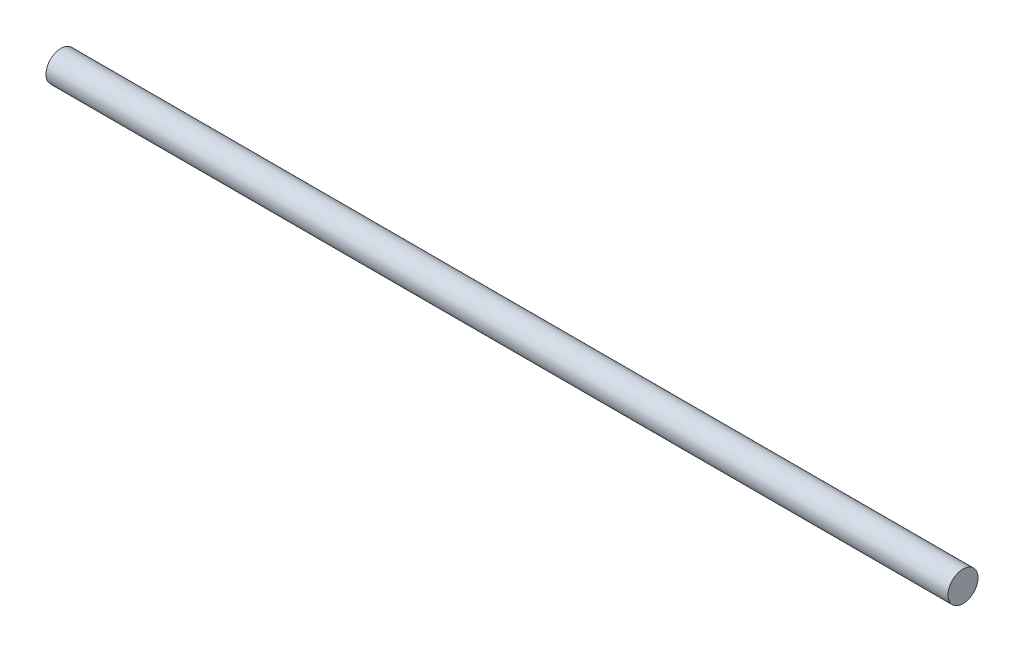
from build123d import *

# Parameters (mm, degrees)
SKETCH1_R           = 3.175
BOSS_EXTRUDE1_DEPTH = 190.763396412


with BuildPart() as part:
    # Sketch1 → Boss-Extrude1 (new body)
    with BuildSketch(Plane.YZ):
        with Locations(Location((0, 0, 0), (0, 0, 270))):
            Circle(SKETCH1_R)
    extrude(amount=BOSS_EXTRUDE1_DEPTH)


solid = part.part
